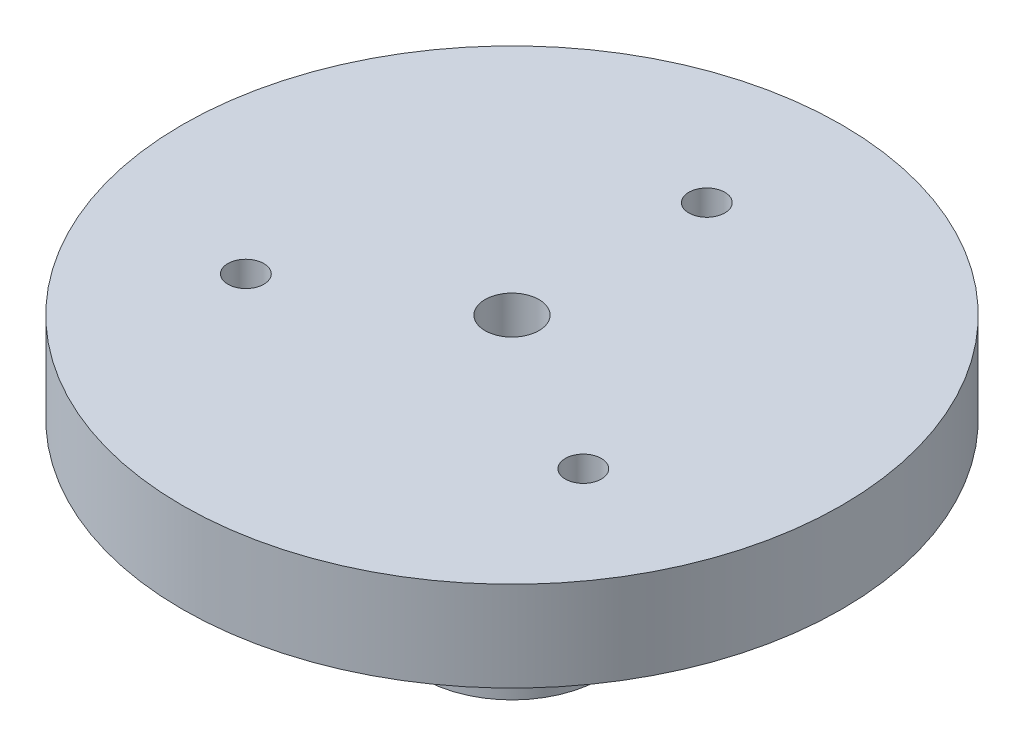
from build123d import *

# Parameters (mm, degrees)
SKETCH1_R               = 11.000723037
SKETCH1_R_2             = 0.9
SKETCH1_R_3             = 0.6
DISCO_APONEUROSIS_DEPTH = 3


with BuildPart() as part:
    # Sketch1 → Disco_aponeurosis (new body)
    with BuildSketch(Plane(origin=(0, -164, 0), x_dir=(1, 0, 0), z_dir=(0, 1, 0))):
        with Locations(Location((0, 0, 0), (0, 0, 270))):
            Circle(SKETCH1_R)
        with Locations(Location((0, 0, 0), (0, 0, 270))):
            Circle(SKETCH1_R_2, mode=Mode.SUBTRACT)
        with Locations(Location((0, 6.5, 0), (0, 0, 270))):
            Circle(SKETCH1_R_3, mode=Mode.SUBTRACT)
        with Locations(Location((-5.63, -3.25, 0), (0, 0, 270))):
            Circle(SKETCH1_R_3, mode=Mode.SUBTRACT)
        with Locations(Location((5.63, -3.25, 0), (0, 0, 270))):
            Circle(SKETCH1_R_3, mode=Mode.SUBTRACT)
    extrude(amount=DISCO_APONEUROSIS_DEPTH)

    # Sketch2 → Boca_tendon (revolve)
    with BuildSketch(Plane.XY, mode=Mode.PRIVATE) as boca_tendon_sk:
        Polygon((0, -164), (3, -164), (3, -170), (1.2, -170), (0, -170), align=None)
    revolve(boca_tendon_sk.sketch.rotate(Axis((0, -174, 0), (0, 1, 0)), 90), axis=Axis((0, -174, 0), (0, 1, 0)))


solid = part.part
